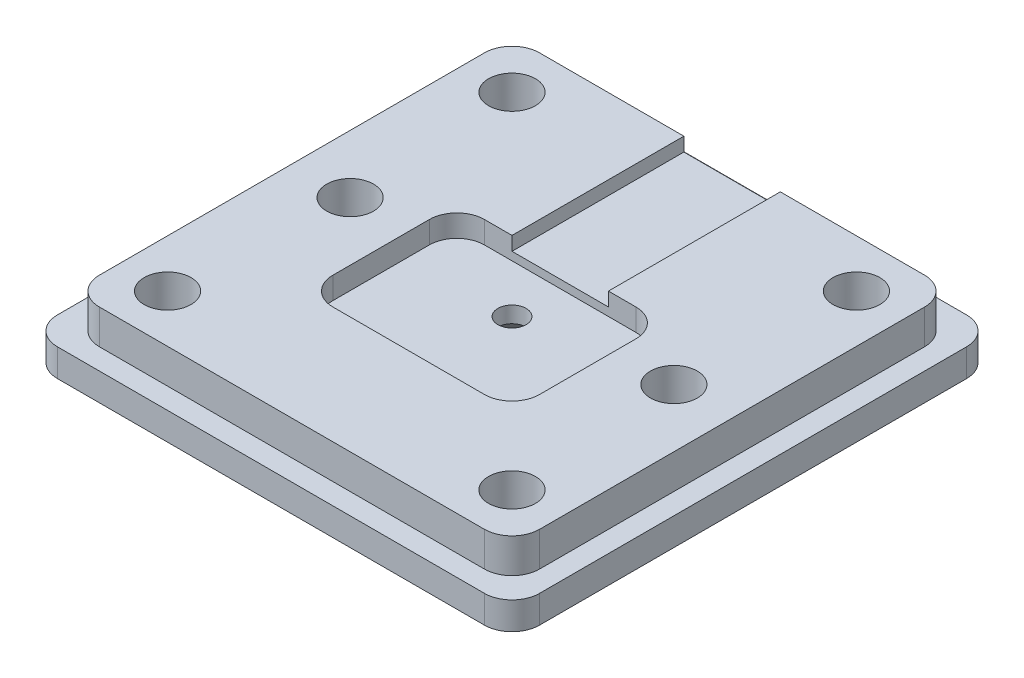
from build123d import *

# Parameters (mm, degrees)
EXTRUDE_1_DEPTH              = 2.5
EXTRUDE_2_DEPTH              = 2
HOLE_WIZARD_3_4_D            = 3.4
CUT_EXTRUDE_2193_DEPTH       = 1.6
HOLE_WIZARD_3_D              = 3.4
HOLE_WIZARD_3_CSINK_D        = 6.3
HOLE_WIZARD_3_CSINK_ANGLE    = 90
SKETCH_8_W                   = 7
SKETCH_8_H                   = 12.475
CUT_EXTRUDE_3485_DEPTH       = 1
SKETCH_11_R                  = 3.5
CUT_EXTRUDE_7_1_DEPTH        = 1
HOLE_WIZARD_M2_5_D           = 2.05
HOLE_WIZARD_M2_5_CSINK_D     = 5.5
HOLE_WIZARD_M2_5_CSINK_ANGLE = 90


with BuildPart() as part:
    # Эскиз1 → Бобышка-Вытянуть1 (new body)
    with BuildSketch(Plane(origin=(0, 0, 0), x_dir=(1, 0, 0), z_dir=(0, 1, 0))):
        with BuildLine():
            Line((-13.975, 15.975), (13.975, 15.975))
            ThreePointArc((13.975, 15.975), (15.389213562, 15.389213562), (15.975, 13.975))
            Line((15.975, 13.975), (15.975, -13.975))
            ThreePointArc((15.975, -13.975), (15.389213562, -15.389213562), (13.975, -15.975))
            Line((13.975, -15.975), (-13.975, -15.975))
            ThreePointArc((-13.975, -15.975), (-15.389213562, -15.389213562), (-15.975, -13.975))
            Line((-15.975, -13.975), (-15.975, 13.975))
            ThreePointArc((-15.975, 13.975), (-15.389213562, 15.389213562), (-13.975, 15.975))
        make_face()
    extrude(amount=EXTRUDE_1_DEPTH)

    # Эскиз9 → Бобышка-Вытянуть2 (add)
    with BuildSketch(Plane.XZ):
        with BuildLine():
            Line((-15.5, 17.5), (15.5, 17.5))
            ThreePointArc((15.5, 17.5), (16.914213562, 16.914213562), (17.5, 15.5))
            Line((17.5, 15.5), (17.5, -15.5))
            ThreePointArc((17.5, -15.5), (16.914213562, -16.914213562), (15.5, -17.5))
            Line((15.5, -17.5), (-15.5, -17.5))
            ThreePointArc((-15.5, -17.5), (-16.914213562, -16.914213562), (-17.5, -15.5))
            Line((-17.5, -15.5), (-17.5, 15.5))
            ThreePointArc((-17.5, 15.5), (-16.914213562, 16.914213562), (-15.5, 17.5))
        make_face()
    extrude(amount=EXTRUDE_2_DEPTH)

    # Диаметр отверстия Ø3.4 (through all)
    with Locations(Plane.XZ.offset(2)):
        with Locations((-12.5, -12.5), (12.5, -12.5), (12.5, 12.5), (-12.5, 12.5)):
            Hole(HOLE_WIZARD_3_4_D / 2)

    # Эскиз4 → Cut-Extrude 2193 (cut)
    with BuildSketch(Plane(origin=(0, 2.5, 0), x_dir=(1, 0, 0), z_dir=(0, 1, 0))):
        with BuildLine():
            Line((-5.5, 3.5), (5.5, 3.5))
            ThreePointArc((5.5, 3.5), (6.914213562, 2.914213562), (7.5, 1.5))
            Line((7.5, 1.5), (7.5, -5.5))
            ThreePointArc((7.5, -5.5), (6.914213562, -6.914213562), (5.5, -7.5))
            Line((5.5, -7.5), (-5.5, -7.5))
            ThreePointArc((-5.5, -7.5), (-6.914213562, -6.914213562), (-7.5, -5.5))
            Line((-7.5, -5.5), (-7.5, 1.5))
            ThreePointArc((-7.5, 1.5), (-6.914213562, 2.914213562), (-5.5, 3.5))
        make_face()
    extrude(amount=-CUT_EXTRUDE_2193_DEPTH, mode=Mode.SUBTRACT)

    # Крепление дна М3 (through all)
    with Locations(Plane(origin=(0, -2, 0), x_dir=(-1, 0, 0), z_dir=(0, -1, 0))):
        with Locations((11.75, 0), (-11.75, 0)):
            CounterSinkHole(HOLE_WIZARD_3_D / 2, HOLE_WIZARD_3_CSINK_D / 2, counter_sink_angle=HOLE_WIZARD_3_CSINK_ANGLE)

    # Эскиз8 → Cut-Extrude 3485 (cut)
    with BuildSketch(Plane(origin=(0, 2.5, 0), x_dir=(1, 0, 0), z_dir=(0, 1, 0))):
        with Locations((0, 9.7375)):
            Rectangle(SKETCH_8_W, SKETCH_8_H)
    extrude(amount=-CUT_EXTRUDE_3485_DEPTH, mode=Mode.SUBTRACT)

    # Эскиз11 → Вырез магнитов 7*1 (cut)
    with BuildSketch(Plane.XZ.offset(2)):
        with Locations(Location((-7.5, 7.5, 0), (0, 0, 270))):
            Circle(SKETCH_11_R)
        with Locations(Location((7.5, 7.5, 0), (0, 0, 270))):
            Circle(SKETCH_11_R)
        with Locations(Location((-7.5, -7.5, 0), (0, 0, 270))):
            Circle(SKETCH_11_R)
        with Locations(Location((7.5, -7.5, 0), (0, 0, 270))):
            Circle(SKETCH_11_R)
    extrude(amount=-CUT_EXTRUDE_7_1_DEPTH, mode=Mode.SUBTRACT)

    # Отверстие для настройки M2.5 (through all)
    with Locations(Plane(origin=(0, -2, 0), x_dir=(-1, 0, 0), z_dir=(0, -1, 0))):
        with Locations((0, 0)):
            CounterSinkHole(HOLE_WIZARD_M2_5_D / 2, HOLE_WIZARD_M2_5_CSINK_D / 2, counter_sink_angle=HOLE_WIZARD_M2_5_CSINK_ANGLE)


solid = part.part
